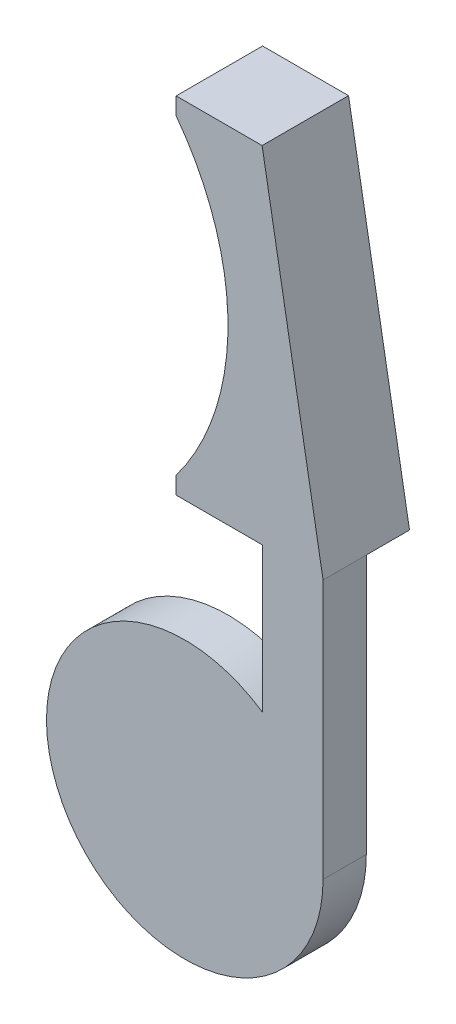
from build123d import *

# Parameters (mm, degrees)
SKETCH1_R           = 20.32
BOSS_EXTRUDE1_DEPTH = 6.35
SKETCH2_R           = 4.445
SKETCH2_R_2         = 3.175
BOSS_EXTRUDE2_DEPTH = 2.54
SKETCH4_W           = 8.89
SKETCH4_H           = 38.1
BOSS_EXTRUDE3_DEPTH = 6.35
BOSS_EXTRUDE4_DEPTH = 12.7


with BuildPart() as part:
    # Sketch1 → Boss-Extrude1 (new body)
    with BuildSketch(Plane.XY):
        Circle(SKETCH1_R)
    extrude(amount=BOSS_EXTRUDE1_DEPTH)

    # Sketch2 → Boss-Extrude2 (add)
    with BuildSketch(Plane(origin=(0, 0, 0), x_dir=(-1, 0, 0), z_dir=(0, 0, -1))):
        with Locations(Location((0, 0, 0), (0, 0, 180))):
            Circle(SKETCH2_R)
        Circle(SKETCH2_R_2, mode=Mode.SUBTRACT)
    extrude(amount=BOSS_EXTRUDE2_DEPTH)

    # Sketch4 → Boss-Extrude3 (add)
    with BuildSketch(Plane.XY.offset(6.35)):
        with Locations((15.875, 19.05)):
            Rectangle(SKETCH4_W, SKETCH4_H)
    extrude(amount=-BOSS_EXTRUDE3_DEPTH)

    # Sketch5 → Boss-Extrude4 (add)
    with BuildSketch(Plane.XY.offset(6.35)):
        with BuildLine():
            Line((20.32, 38.1), (-1.27, 38.1))
            Line((-1.27, 38.1), (-1.27, 40.64))
            ThreePointArc((-1.27, 40.64), (6.35, 63.5), (-1.27, 86.36))
            Line((-1.27, 86.36), (-1.27, 88.9))
            Line((-1.27, 88.9), (11.36258938, 88.9))
            Line((11.36258938, 88.9), (20.32, 38.1))
        make_face()
    extrude(amount=-BOSS_EXTRUDE4_DEPTH)


solid = part.part
